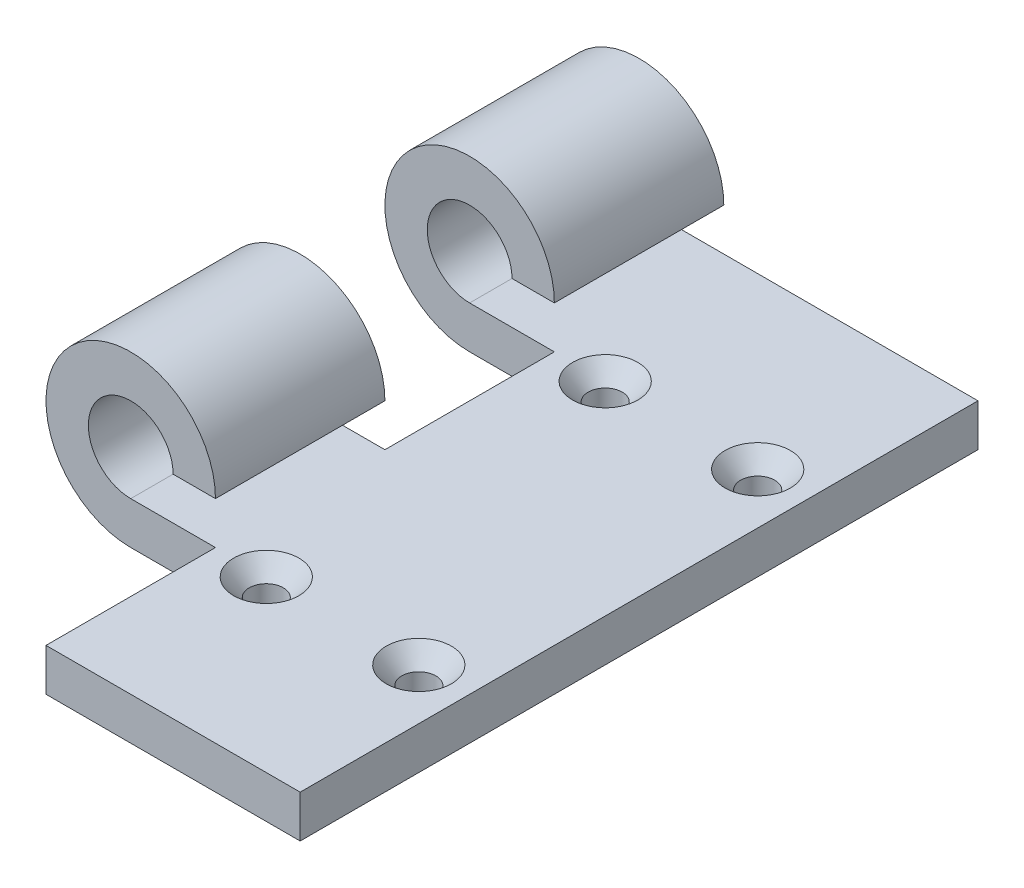
from build123d import *

# Parameters (mm, degrees)
EXTRUDE_THIN1_DEPTH                             = 50.8
SKETCH3_W                                       = 25.4
SKETCH3_H                                       = 25.4
CUT_EXTRUDE1_DEPTH                              = 75.324844433
LPATTERN1_COUNT                                 = 2
LPATTERN1_PITCH                                 = 50.8
CSK_FOR_10_FLAT_HEAD_MACHINE_SCREW1_D           = 5.1054
CSK_FOR_10_FLAT_HEAD_MACHINE_SCREW1_CSINK_D     = 9.779
CSK_FOR_10_FLAT_HEAD_MACHINE_SCREW1_CSINK_ANGLE = 82
LPATTERN2_COUNT                                 = 2
LPATTERN2_PITCH                                 = 50.8
LPATTERN2_COUNT_DIR2                            = 2
LPATTERN2_PITCH_DIR2                            = 22.86


with BuildPart() as part:
    # Sketch1 → Extrude-Thin1 (new, symmetric)
    with BuildSketch(Plane.XY):
        with BuildLine():
            ThreePointArc((12.7, 0), (-8.980256121, 8.980256121), (0, -12.7))
            Line((0, -12.7), (50.8, -12.7))
            Line((50.8, -12.7), (50.8, -6.35))
            Line((50.8, -6.35), (0, -6.35))
            ThreePointArc((0, -6.35), (-4.490128061, 4.490128061), (6.35, 0))
            Line((6.35, 0), (12.7, 0))
        make_face()
    extrude(amount=EXTRUDE_THIN1_DEPTH, both=True)

    # Sketch3 → Cut-Extrude1 (cut, symmetric)
    with BuildSketch(Plane(origin=(0, -6.35, 0), x_dir=(1, 0, 0), z_dir=(0, 1, 0))):
        with Locations((0, -38.1)):
            Rectangle(SKETCH3_W, SKETCH3_H)
    cut_extrude1 = extrude(amount=CUT_EXTRUDE1_DEPTH, both=True, mode=Mode.SUBTRACT)

    # LPattern1: Cut-Extrude1 ×2
    with Locations(*[(0, 0, -i * LPATTERN1_PITCH) for i in range(1, LPATTERN1_COUNT)]):
        add(cut_extrude1, mode=Mode.SUBTRACT)

    # CSK for #10 Flat Head Machine Screw1 (through all)
    with Locations(Plane(origin=(0, -6.35, 0), x_dir=(1, 0, 0), z_dir=(0, 1, 0))):
        with Locations((20.32, 25.4)):
            csk_for_10_flat_head_machine_screw1 = CounterSinkHole(CSK_FOR_10_FLAT_HEAD_MACHINE_SCREW1_D / 2, CSK_FOR_10_FLAT_HEAD_MACHINE_SCREW1_CSINK_D / 2, counter_sink_angle=CSK_FOR_10_FLAT_HEAD_MACHINE_SCREW1_CSINK_ANGLE)

    # LPattern2: CSK for _10 Flat Head Machine Screw1 2 × 2
    with Locations(*[(j * LPATTERN2_PITCH_DIR2, 0, i * LPATTERN2_PITCH) for i in range(LPATTERN2_COUNT) for j in range(LPATTERN2_COUNT_DIR2) if (i, j) != (0, 0)]):
        add(csk_for_10_flat_head_machine_screw1, mode=Mode.SUBTRACT)


solid = part.part
